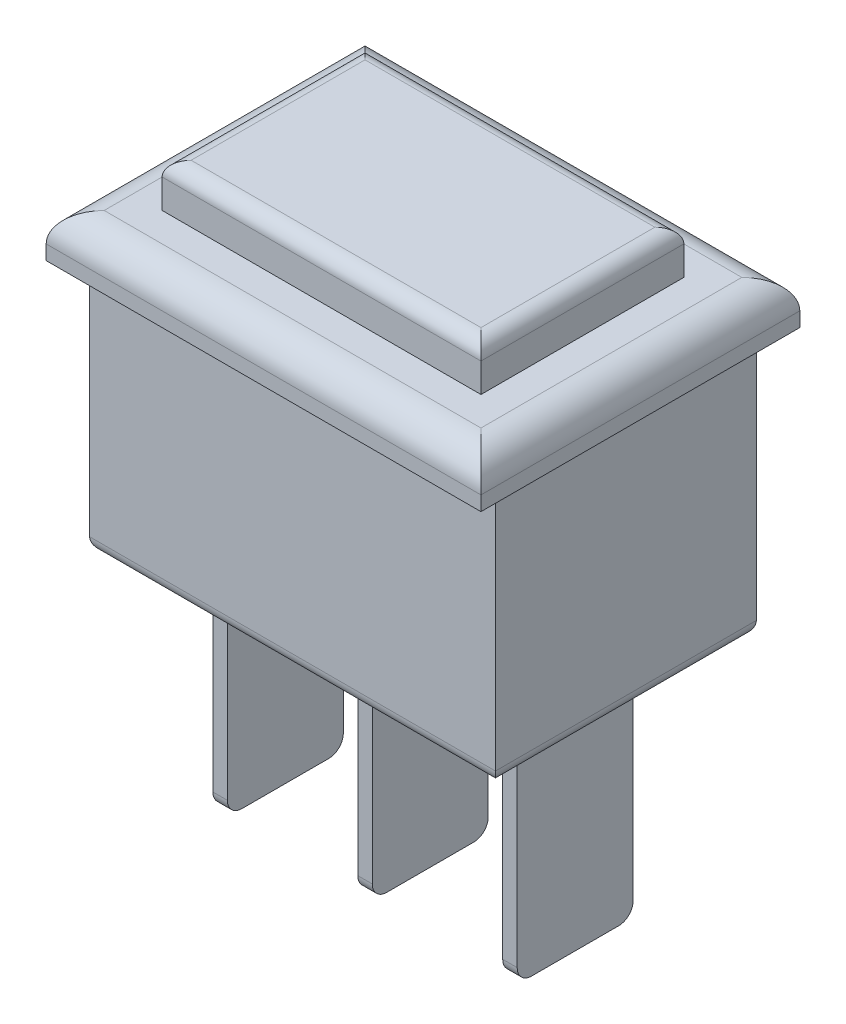
from build123d import *

# Parameters (mm, degrees)
SKETCH_1_W      = 14
SKETCH_1_H      = 9
EXTRUDE_1_DEPTH = 9
SKETCH_2_W      = 15
SKETCH_2_H      = 11
EXTRUDE_2_DEPTH = 1.5
SKETCH_3_W      = 11
SKETCH_3_H      = 7
EXTRUDE_3_DEPTH = 1.5
SKETCH_4_W      = 0.5
SKETCH_4_H      = 4
EXTRUDE_4_DEPTH = 8
FILLET_1_R      = 1
FILLET_2_R      = 0.5
FILLET_3_R      = 0.5
FILLET_4_R      = 0.5


with BuildPart() as part:
    # Эскиз1 → Бобышка-Вытянуть1 (new body)
    with BuildSketch(Plane(origin=(0, 0, 0), x_dir=(1, 0, 0), z_dir=(0, 1, 0))):
        Rectangle(SKETCH_1_W, SKETCH_1_H)
    extrude(amount=EXTRUDE_1_DEPTH)

    # Эскиз2 → Бобышка-Вытянуть2 (add)
    with BuildSketch(Plane(origin=(0, 9, 0), x_dir=(1, 0, 0), z_dir=(0, 1, 0))):
        Rectangle(SKETCH_2_W, SKETCH_2_H)
    extrude(amount=EXTRUDE_2_DEPTH)

    # Эскиз3 → Бобышка-Вытянуть3 (add)
    with BuildSketch(Plane(origin=(0, 10.5, 0), x_dir=(1, 0, 0), z_dir=(0, 1, 0))):
        Rectangle(SKETCH_3_W, SKETCH_3_H)
    extrude(amount=EXTRUDE_3_DEPTH)

    # Эскиз4 → Бобышка-Вытянуть4 (add)
    with BuildSketch(Plane.XZ):
        Rectangle(SKETCH_4_W, SKETCH_4_H)
        with Locations((5, 0)):
            Rectangle(SKETCH_4_W, SKETCH_4_H)
        with Locations((-5, 0)):
            Rectangle(SKETCH_4_W, SKETCH_4_H)
    extrude(amount=EXTRUDE_4_DEPTH)

    # Скругление1
    fillet_1_edges = [part.edges().sort_by_distance(p)[0] for p in [
        (7.5, 10.5, 0),
        (0, 10.5, -5.5),
        (-7.5, 10.5, 0),
        (0, 10.5, 5.5),
    ]]
    fillet(fillet_1_edges, radius=FILLET_1_R)

    # Скругление2
    fillet_2_edges = [part.edges().sort_by_distance(p)[0] for p in [
        (5.5, 12, 0),
        (0, 12, -3.5),
        (-5.5, 12, 0),
        (0, 12, 3.5),
    ]]
    fillet(fillet_2_edges, radius=FILLET_2_R)

    # Скругление3
    fillet_3_edges = [part.edges().sort_by_distance(p)[0] for p in [
        (0, 0, 4.5),
        (-7, 0, 0),
        (0, 0, -4.5),
        (7, 0, 0),
    ]]
    fillet(fillet_3_edges, radius=FILLET_3_R)

    # Скругление4
    fillet_4_edges = [part.edges().sort_by_distance(p)[0] for p in [
        (0, 0, -2),
        (0.25, 0, 0),
        (0, -8, 2),
        (0, -8, -2),
        (-0.25, 0, 0),
        (0, 0, 2),
        (5, 0, -2),
        (5.25, 0, 0),
        (5, -8, 2),
        (5, -8, -2),
        (4.75, 0, 0),
        (5, 0, 2),
        (-5, 0, -2),
        (-4.75, 0, 0),
        (-5, -8, 2),
        (-5, -8, -2),
        (-5.25, 0, 0),
        (-5, 0, 2),
    ]]
    fillet(fillet_4_edges, radius=FILLET_4_R)


solid = part.part
